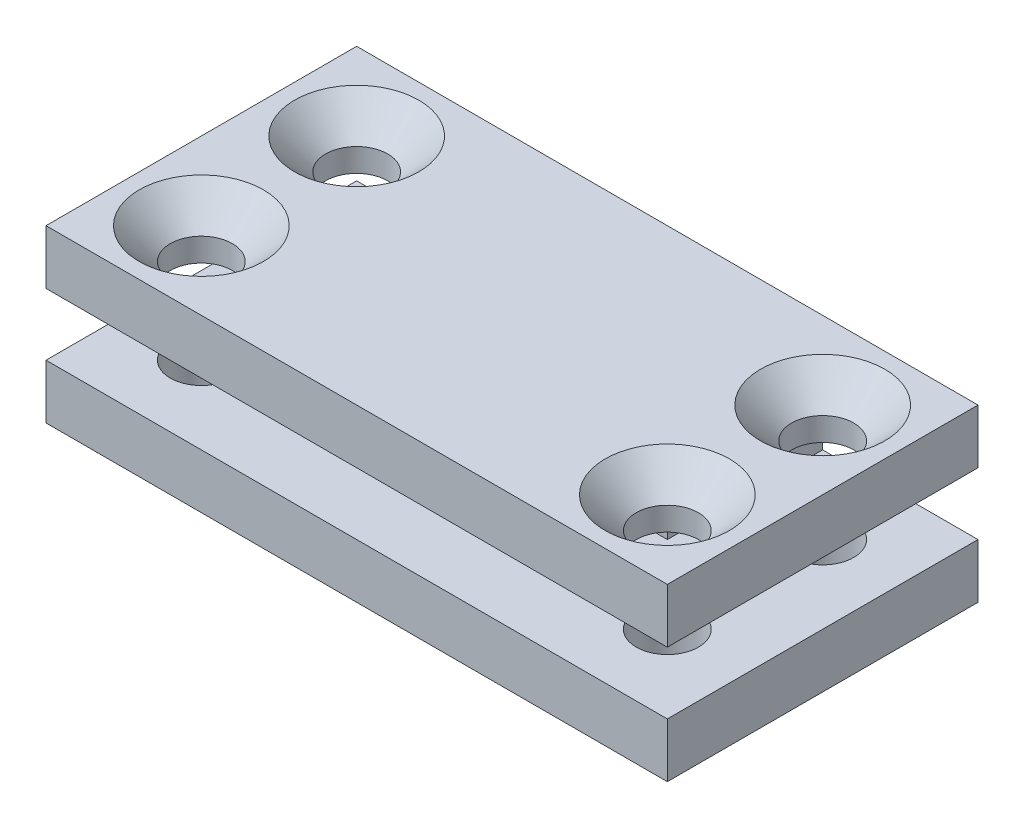
from build123d import *

# Parameters (mm, degrees)
SKETCH_1_R          = 1.5
EXTRUDE_1_DEPTH     = 5
SKETCH_3_W          = 40
SKETCH_3_H          = 3.5
EXTRUDE_2_DEPTH     = 10
SKETCH_2_R          = 2
CUT_EXTRUDE_1_DEPTH = 28.313000567
CHAMFER_1_SIZE      = 2


with BuildPart() as part:
    # 草图1 → 凸台-拉伸1 (new, symmetric)
    with BuildSketch(Plane.XY):
        Polygon((20, 11), (-20, 11), (-20, 7.5), (-10, 7.5), (-10, 3.5), (-20, 3.5), (-20, 0), (0, 0), (20, 0), (20, 3.5), (10, 3.5), (10, 7.5), (20, 7.5), align=None)
        with Locations((0, 5)):
            Circle(SKETCH_1_R, mode=Mode.SUBTRACT)
    extrude(amount=EXTRUDE_1_DEPTH, both=True)

    # 草图3 → 凸台-拉伸2 (add)
    with BuildSketch(Plane.XY.offset(5)):
        with Locations((0, 9.25)):
            Rectangle(SKETCH_3_W, SKETCH_3_H)
        with Locations((0, 1.75)):
            Rectangle(SKETCH_3_W, SKETCH_3_H)
    extrude(amount=EXTRUDE_2_DEPTH)

    # 草图2 → 切除-拉伸1 (cut, through all)
    with BuildSketch(Plane(origin=(0, 0, 0), x_dir=(1, 0, 0), z_dir=(0, 1, 0))):
        with Locations(Location((-15, 0, 0), (0, 0, 270))):
            Circle(SKETCH_2_R)
        with Locations(Location((15, 0, 0), (0, 0, 90))):
            Circle(SKETCH_2_R)
        with Locations(Location((-15, -10, 0), (0, 0, 270))):
            Circle(SKETCH_2_R)
        with Locations(Location((15, -10, 0), (0, 0, 90))):
            Circle(SKETCH_2_R)
    extrude(amount=CUT_EXTRUDE_1_DEPTH, mode=Mode.SUBTRACT)

    # 倒角1
    chamfer_1_edges = [part.edges().sort_by_distance(p)[0] for p in [
        (15, 11, 2),
        (-15, 11, 8),
        (15, 11, 12),
        (-15, 11, -2),
    ]]
    chamfer(chamfer_1_edges, length=CHAMFER_1_SIZE)


solid = part.part
